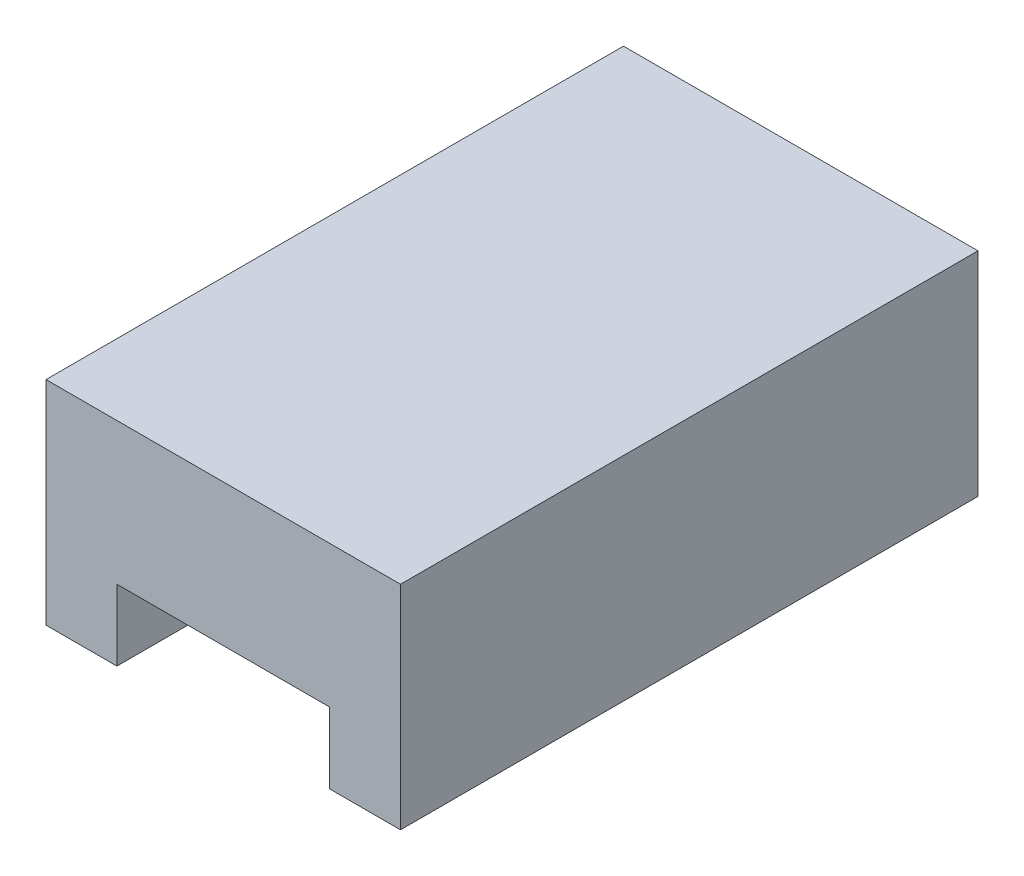
from build123d import *

# Parameters (mm, degrees)
EXTRUDE1_DEPTH = 827.532


with BuildPart() as part:
    # Sketch1 → Extrude1 (new body)
    with BuildSketch(Plane.XY):
        Polygon((0, 0), (101.6, 0), (101.6, 101.6), (406.4, 101.6), (406.4, 0), (508, 0), (508, 304.8), (0, 304.8), align=None)
    extrude(amount=EXTRUDE1_DEPTH)


solid = part.part
